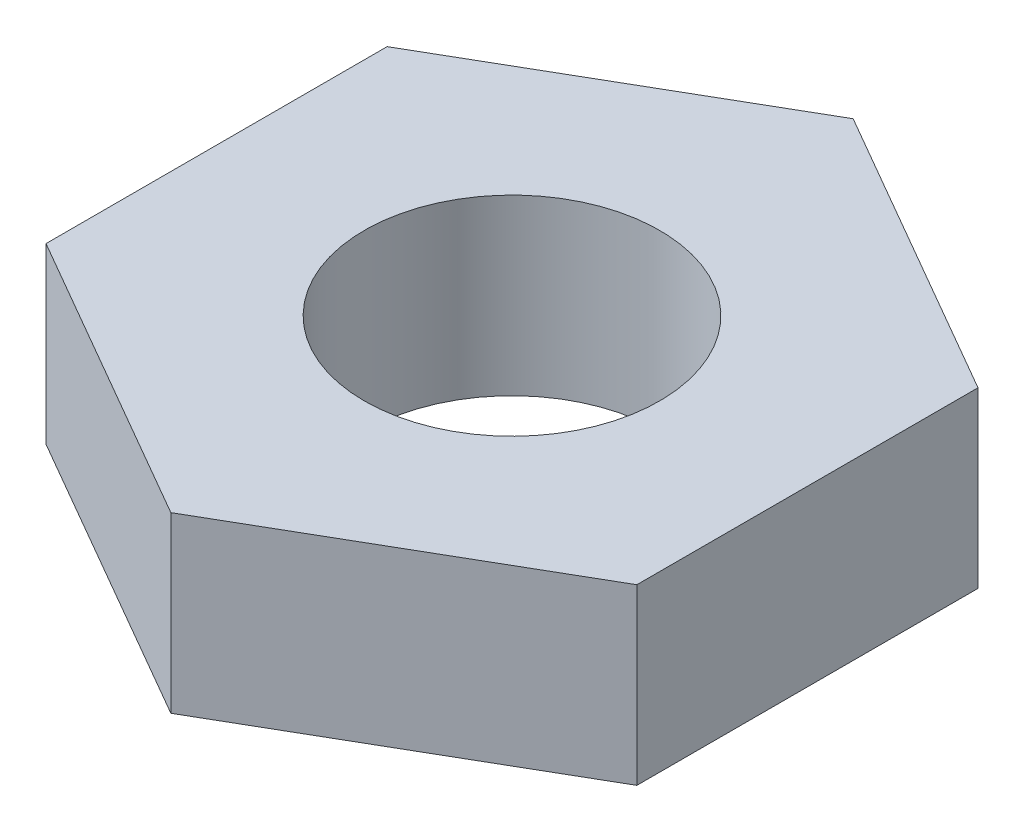
from build123d import *

# Parameters (mm, degrees)
NUT_SK_R  = 4.25
NUT_DEPTH = 5


with BuildPart() as part:
    # Nut sk → Nut (new body)
    with BuildSketch(Plane(origin=(0, 0, 0), x_dir=(1, 0, 0), z_dir=(0, 1, 0))):
        Polygon((8.5, -4.907477288), (8.5, 4.907477288), (0, 9.814954576), (-8.5, 4.907477288), (-8.5, -4.907477288), (0, -9.814954576), align=None)
        with Locations(Location((0, 0, 0), (0, 0, 270))):
            Circle(NUT_SK_R, mode=Mode.SUBTRACT)
    extrude(amount=NUT_DEPTH)


solid = part.part
